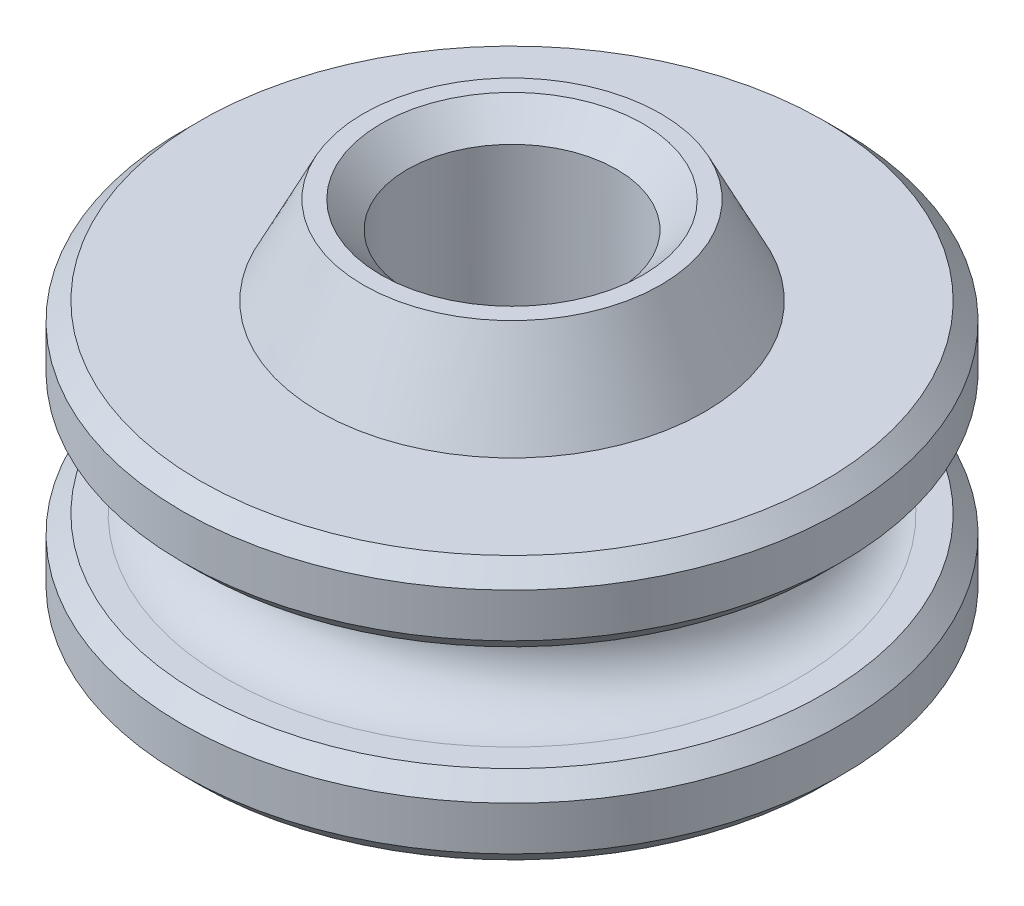
from build123d import *

# Parameters (mm, degrees)
CHAMFER1_SIZE = 0.3
CHAMFER2_SIZE = 0.2


with BuildPart() as part:
    # Sketch1 → Revolve1 (revolve)
    with BuildSketch(Plane(origin=(0, 0, 0), x_dir=(0, 0, -1), z_dir=(1, 0, 0)), mode=Mode.PRIVATE) as revolve1_sk:
        with BuildLine():
            Line((1.191, 2.5), (1.191, -1.5))
            Line((1.191, -1.5), (2.191, -1.5))
            Line((2.191, -1.5), (3.75, -1.5))
            Line((3.75, -1.5), (3.75, -0.6))
            Line((3.75, -0.6), (3.25, -0.6))
            ThreePointArc((3.25, -0.6), (2.65, 0), (3.25, 0.6))
            Line((3.25, 0.6), (3.75, 0.6))
            Line((3.75, 0.6), (3.75, 1.5))
            Line((3.75, 1.5), (2.191, 1.5))
            Line((2.191, 1.5), (1.691, 2.5))
            Line((1.691, 2.5), (1.191, 2.5))
        make_face()
    revolve(revolve1_sk.sketch.rotate(Axis((0, 2.7, 0), (0, -1, 0)), 180), axis=Axis((0, 2.7, 0), (0, -1, 0)))

    # Chamfer1
    chamfer1_edges = [part.edges().sort_by_distance(p)[0] for p in [
        (0, -1.5, -1.191),
        (0, 2.5, -1.191),
    ]]
    chamfer(chamfer1_edges, length=CHAMFER1_SIZE)

    # Chamfer2
    chamfer2_edges = [part.edges().sort_by_distance(p)[0] for p in [
        (0, 1.5, -3.75),
        (0, 0.6, -3.75),
        (0, -0.6, -3.75),
        (0, -1.5, -3.75),
    ]]
    chamfer(chamfer2_edges, length=CHAMFER2_SIZE)


solid = part.part
